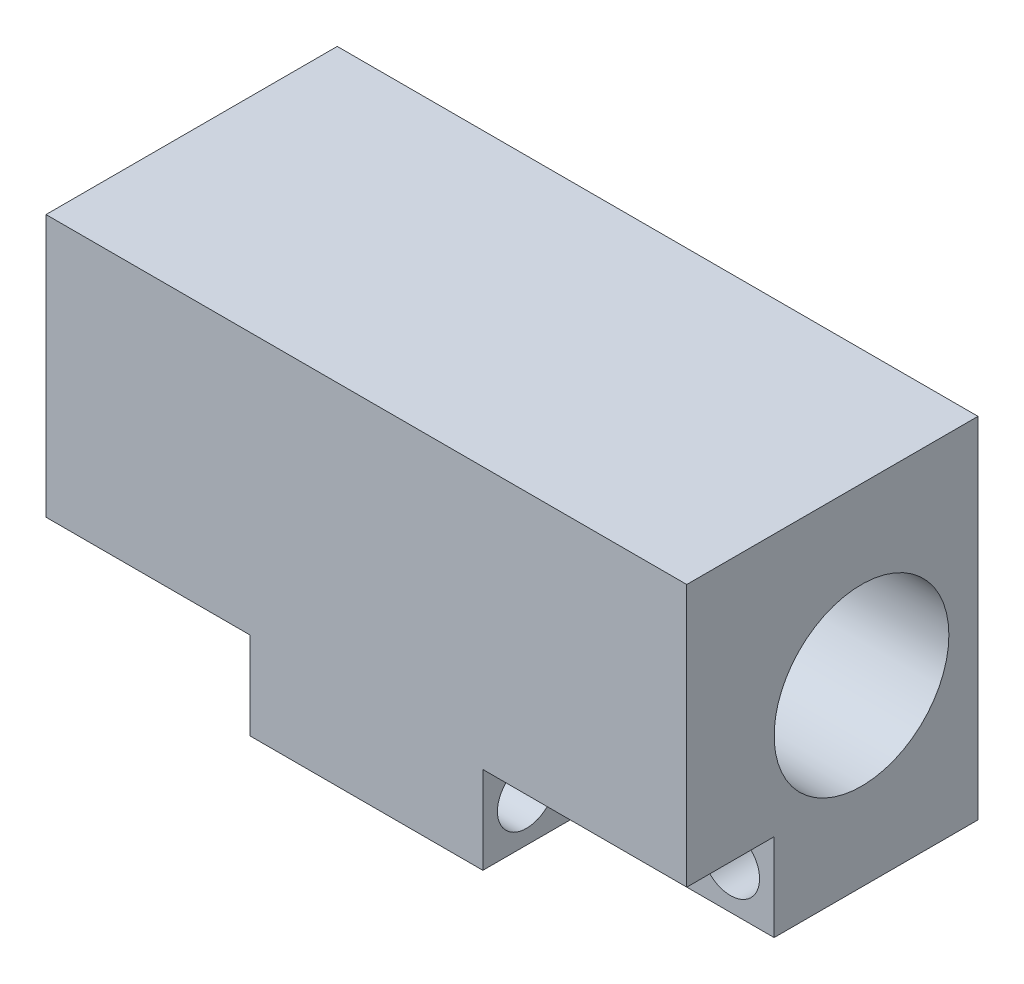
from build123d import *

# Parameters (mm, degrees)
BOSS_EXTRUDE1_DEPTH     = 12
SKETCH5_R               = 1
CUT_EXTRUDE1_DEPTH      = 10
CUT_EXTRUDE2_DEPTH      = 3
CUT_EXTRUDE2_DEPTH_BACK = 3
CUT_EXTRUDE3_DEPTH      = 21.976176963
CUT_EXTRUDE3_DEPTH_BACK = 21.976176963
SKETCH7_R               = 1.5
SKETCH10_W              = 7
SKETCH10_H              = 3
CUT_EXTRUDE4_DEPTH      = 3
SKETCH9_R               = 1
CUT_EXTRUDE5_DEPTH      = 27.981475126
SKETCH12_R              = 3
CUT_EXTRUDE6_DEPTH      = 6.5
CUT_EXTRUDE7_DEPTH      = 6.5


with BuildPart() as part:
    # Sketch2 → Boss-Extrude1 (new body)
    with BuildSketch(Plane(origin=(0, 0, 0), x_dir=(1, 0, 0), z_dir=(0, 1, 0))):
        Polygon((0, 10), (11, 10), (11, 0), (-11, 0), (-11, 10), align=None)
    extrude(amount=BOSS_EXTRUDE1_DEPTH)

    # Sketch5 → Cut-Extrude1 (cut)
    with BuildSketch(Plane(origin=(0, 0, -10), x_dir=(-1, 0, 0), z_dir=(0, 0, -1))):
        with Locations((9.5, 1.5)):
            Circle(SKETCH5_R)
    cut_extrude1 = extrude(amount=-CUT_EXTRUDE1_DEPTH, mode=Mode.SUBTRACT)

    # Sketch6 → Cut-Extrude2 (cut, two sides: drawn at the far end of the back side and taken through both)
    with BuildSketch(Plane(origin=(0, 0, 0), x_dir=(0, 0, -1), z_dir=(1, 0, 0)).offset(-CUT_EXTRUDE2_DEPTH_BACK)):
        with BuildLine():
            Line((6, 9.2), (10, 9.2))
            Line((10, 9.2), (10, 2.8))
            Line((10, 2.8), (6, 2.8))
            ThreePointArc((6, 2.8), (2.8, 6), (6, 9.2))
        make_face()
    extrude(amount=CUT_EXTRUDE2_DEPTH + CUT_EXTRUDE2_DEPTH_BACK, mode=Mode.SUBTRACT)

    # Sketch7 → Cut-Extrude3 (cut, two sides: drawn at the far end of the back side and taken through both)
    with BuildSketch(Plane.ZY.offset(-3).offset(-CUT_EXTRUDE3_DEPTH_BACK)):
        with Locations((-6, 6)):
            Circle(SKETCH7_R)
    extrude(amount=CUT_EXTRUDE3_DEPTH + CUT_EXTRUDE3_DEPTH_BACK, mode=Mode.SUBTRACT)

    # Sketch10 → Cut-Extrude4 (cut)
    with BuildSketch(Plane(origin=(0, 0, 0), x_dir=(1, 0, 0), z_dir=(0, 1, 0))):
        with Locations((-7.5, 1.5)):
            Rectangle(SKETCH10_W, SKETCH10_H)
    cut_extrude4 = extrude(amount=CUT_EXTRUDE4_DEPTH, mode=Mode.SUBTRACT)

    # Sketch9 → Cut-Extrude5 (cut, through all)
    with BuildSketch(Plane.ZY.offset(11)):
        with Locations((-1.5, 1.5)):
            Circle(SKETCH9_R)
    extrude(amount=-CUT_EXTRUDE5_DEPTH, mode=Mode.SUBTRACT)

    # Mirror1: Cut-Extrude1, Cut-Extrude4 across plane
    add(cut_extrude1.mirror(Plane(origin=(0, 0, 0), x_dir=(0, 0, 1), z_dir=(1, 0, 0))), mode=Mode.SUBTRACT)
    add(cut_extrude4.mirror(Plane(origin=(0, 0, 0), x_dir=(0, 0, 1), z_dir=(1, 0, 0))), mode=Mode.SUBTRACT)

    # Sketch12 → Cut-Extrude6 (cut)
    with BuildSketch(Plane(origin=(11, 0, 0), x_dir=(0, 0, -1), z_dir=(1, 0, 0))):
        with Locations((6, 6)):
            Circle(SKETCH12_R)
    extrude(amount=-CUT_EXTRUDE6_DEPTH, mode=Mode.SUBTRACT)

    # Sketch13 → Cut-Extrude7 (cut)
    with BuildSketch(Plane.ZY.offset(11)):
        Polygon((-9, 7.732050808), (-9, 4.267949192), (-6, 2.535898385), (-3, 4.267949192), (-3, 7.732050808), (-6, 9.464101615), align=None)
    extrude(amount=-CUT_EXTRUDE7_DEPTH, mode=Mode.SUBTRACT)


solid = part.part
